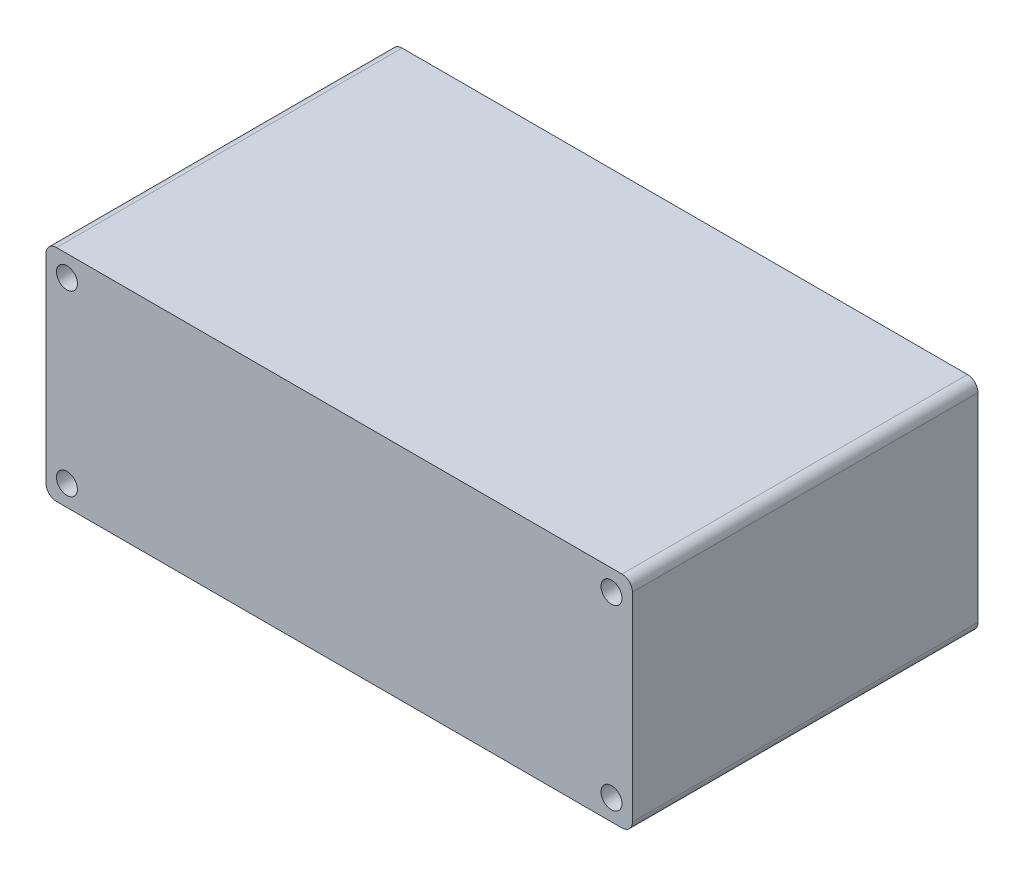
from build123d import *

# Parameters (mm, degrees)
SKETCH1_R               = 1
BOSS_EXTRUDE1_DEPTH     = 30
SKETCH3_R               = 1
BOSS_EXTRUDE2_DEPTH     = 3
CUT_EXTRUDE1_REACH      = 70.622
CUT_EXTRUDE1_END_RADIUS = 9.5
SKETCH4_R               = 5


with BuildPart() as part:
    # Sketch1 → Boss-Extrude1 (new body)
    with BuildSketch(Plane.XY):
        with BuildLine():
            Line((141, -22), (87, -22))
            ThreePointArc((87, -22), (86.292893219, -21.707106781), (86, -21))
            Line((86, -21), (86, -2))
            ThreePointArc((86, -2), (86.292893219, -1.292893219), (87, -1))
            Line((87, -1), (141, -1))
            ThreePointArc((141, -1), (141.707106781, -1.292893219), (142, -2))
            Line((142, -2), (142, -21))
            ThreePointArc((142, -21), (141.707106781, -21.707106781), (141, -22))
        make_face()
        with Locations((140, -3)):
            Circle(SKETCH1_R, mode=Mode.SUBTRACT)
        with Locations((88, -3)):
            Circle(SKETCH1_R, mode=Mode.SUBTRACT)
        with Locations((88, -20)):
            Circle(SKETCH1_R, mode=Mode.SUBTRACT)
        with Locations((140, -20)):
            Circle(SKETCH1_R, mode=Mode.SUBTRACT)
        with BuildLine():
            Line((131.5, -21), (96.5, -21))
            ThreePointArc((96.5, -21), (87, -11.5), (96.5, -2))
            Line((96.5, -2), (131.5, -2))
            ThreePointArc((131.5, -2), (141, -11.5), (131.5, -21))
        make_face(mode=Mode.SUBTRACT)
    extrude(amount=BOSS_EXTRUDE1_DEPTH)

    # Sketch3 → Boss-Extrude2 (add)
    with BuildSketch(Plane.XY.offset(30)):
        with BuildLine():
            Line((86, -2), (86, -21))
            ThreePointArc((86, -21), (86.292893219, -21.707106781), (87, -22))
            Line((87, -22), (141, -22))
            ThreePointArc((141, -22), (141.707106781, -21.707106781), (142, -21))
            Line((142, -21), (142, -2))
            ThreePointArc((142, -2), (141.707106781, -1.292893219), (141, -1))
            Line((141, -1), (87, -1))
            ThreePointArc((87, -1), (86.292893219, -1.292893219), (86, -2))
        make_face()
        with Locations((88, -3)):
            Circle(SKETCH3_R, mode=Mode.SUBTRACT)
        with Locations((88, -20)):
            Circle(SKETCH3_R, mode=Mode.SUBTRACT)
        with Locations((140, -20)):
            Circle(SKETCH3_R, mode=Mode.SUBTRACT)
        with Locations((140, -3)):
            Circle(SKETCH3_R, mode=Mode.SUBTRACT)
    extrude(amount=BOSS_EXTRUDE2_DEPTH)

    # Cut-Extrude1: up to this cylinder (the profile starts outside it)
    cut_extrude1_end = Plane(origin=(96.5, -11.5, 23), z_dir=(0, 0, -1)) * Cylinder(CUT_EXTRUDE1_END_RADIUS, 161.244, mode=Mode.PRIVATE)
    # Sketch4 → Cut-Extrude1 (cut, up to the surface)
    with BuildSketch(Plane.ZY.offset(-86), mode=Mode.PRIVATE) as cut_extrude1_sk1:
        with Locations((23, -11.5)):
            Circle(SKETCH4_R)
    cut_extrude1_tool1 = extrude(cut_extrude1_sk1.sketch, amount=-CUT_EXTRUDE1_REACH, mode=Mode.PRIVATE) - cut_extrude1_end
    add(cut_extrude1_tool1.solids().sort_by_distance((86, -11.5, 23))[0], mode=Mode.SUBTRACT)


solid = part.part
